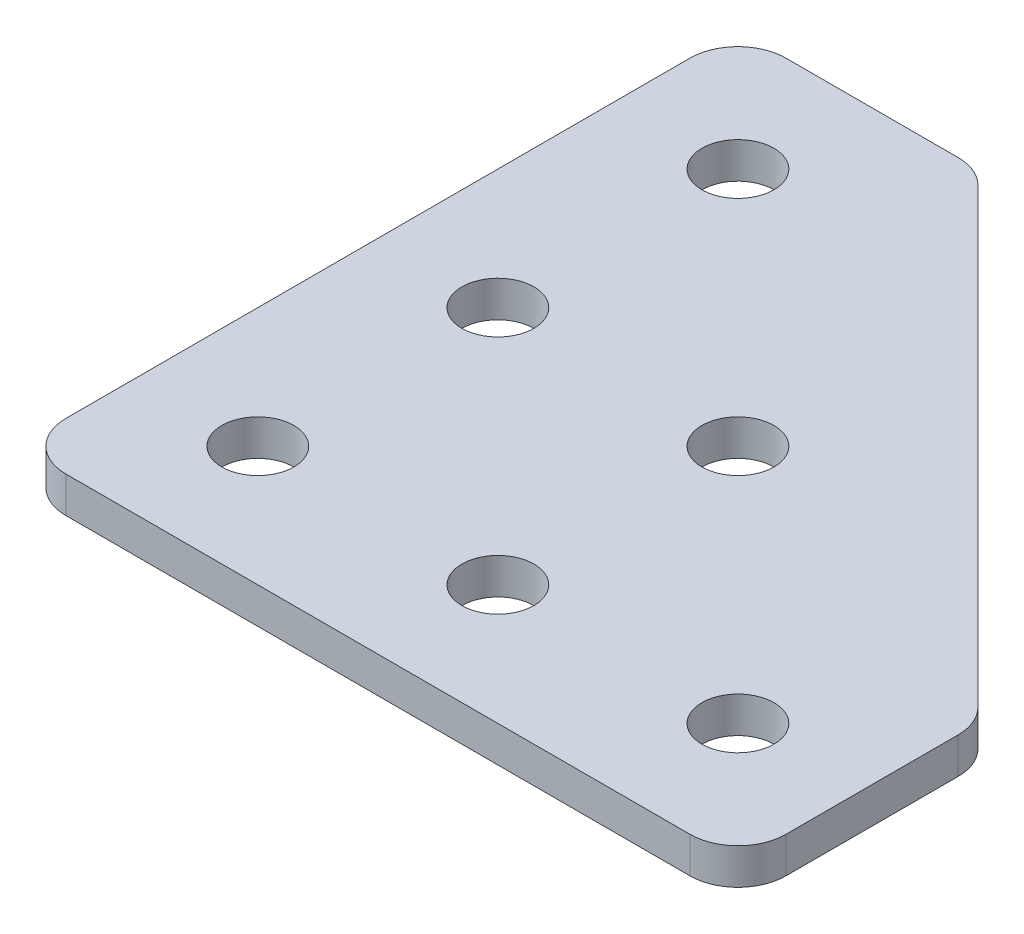
from build123d import *

# Parameters (mm, degrees)
SKETCH_2_R      = 1.5
EXTRUDE_1_DEPTH = 1.5
FILLET_1_R      = 2


with BuildPart() as part:
    # ｽｹｯﾁ2 → ﾎﾞｽ - 押し出し1 (new body)
    with BuildSketch(Plane(origin=(0, 0, 0), x_dir=(1, 0, 0), z_dir=(0, 1, 0))):
        Polygon((0, 0), (30, 0), (30, 10), (10, 30), (0, 30), align=None)
        with Locations(Location((5, 5, 0), (0, 0, 270))):
            Circle(SKETCH_2_R, mode=Mode.SUBTRACT)
        with Locations(Location((25, 5, 0), (0, 0, 270))):
            Circle(SKETCH_2_R, mode=Mode.SUBTRACT)
        with Locations(Location((5, 25, 0), (0, 0, 90))):
            Circle(SKETCH_2_R, mode=Mode.SUBTRACT)
        with Locations(Location((5, 15, 0), (0, 0, 270))):
            Circle(SKETCH_2_R, mode=Mode.SUBTRACT)
        with Locations(Location((15, 5, 0), (0, 0, 270))):
            Circle(SKETCH_2_R, mode=Mode.SUBTRACT)
        with Locations(Location((15, 15, 0), (0, 0, 270))):
            Circle(SKETCH_2_R, mode=Mode.SUBTRACT)
    extrude(amount=EXTRUDE_1_DEPTH)

    # ﾌｨﾚｯﾄ1
    fillet_1_edges = [part.edges().sort_by_distance(p)[0] for p in [
        (0, 0.75, -30),
        (10, 0.75, -30),
        (30, 0.75, -10),
        (30, 0.75, 0),
        (0, 0.75, 0),
    ]]
    fillet(fillet_1_edges, radius=FILLET_1_R)


solid = part.part
